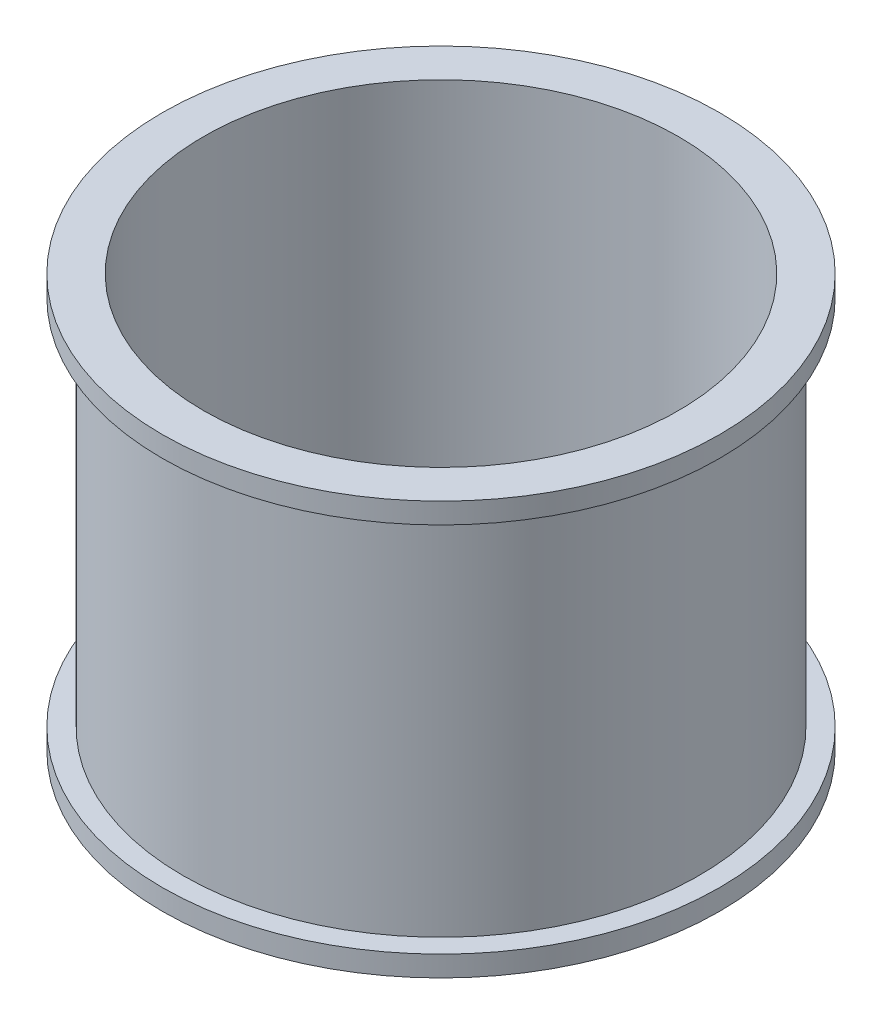
from build123d import *

# Parameters (mm, degrees)
SKETCH1_R           = 6.25
SKETCH1_R_2         = 5.75
BOSS_EXTRUDE1_DEPTH = 5
SKETCH1_3_R         = 6.75
SKETCH1_3_R_2       = 6.25
BOSS_EXTRUDE2_DEPTH = 0.5


with BuildPart() as part:
    # Sketch1 → Boss-Extrude1 (new body)
    with BuildSketch(Plane(origin=(0, 0, 0), x_dir=(1, 0, 0), z_dir=(0, 1, 0))):
        Circle(SKETCH1_R)
        Circle(SKETCH1_R_2, mode=Mode.SUBTRACT)
    boss_extrude1 = extrude(amount=BOSS_EXTRUDE1_DEPTH)

    # Sketch1<3> → Boss-Extrude2 (add)
    with BuildSketch(Plane(origin=(0, 0, 0), x_dir=(1, 0, 0), z_dir=(0, 1, 0))):
        Circle(SKETCH1_3_R)
        Circle(SKETCH1_3_R_2, mode=Mode.SUBTRACT)
    boss_extrude2 = extrude(amount=BOSS_EXTRUDE2_DEPTH)

    # Mirror1: Boss-Extrude1, Boss-Extrude2 across plane
    add(boss_extrude1.mirror(Plane.ZX.offset(5)))
    add(boss_extrude2.mirror(Plane.ZX.offset(5)))


solid = part.part
